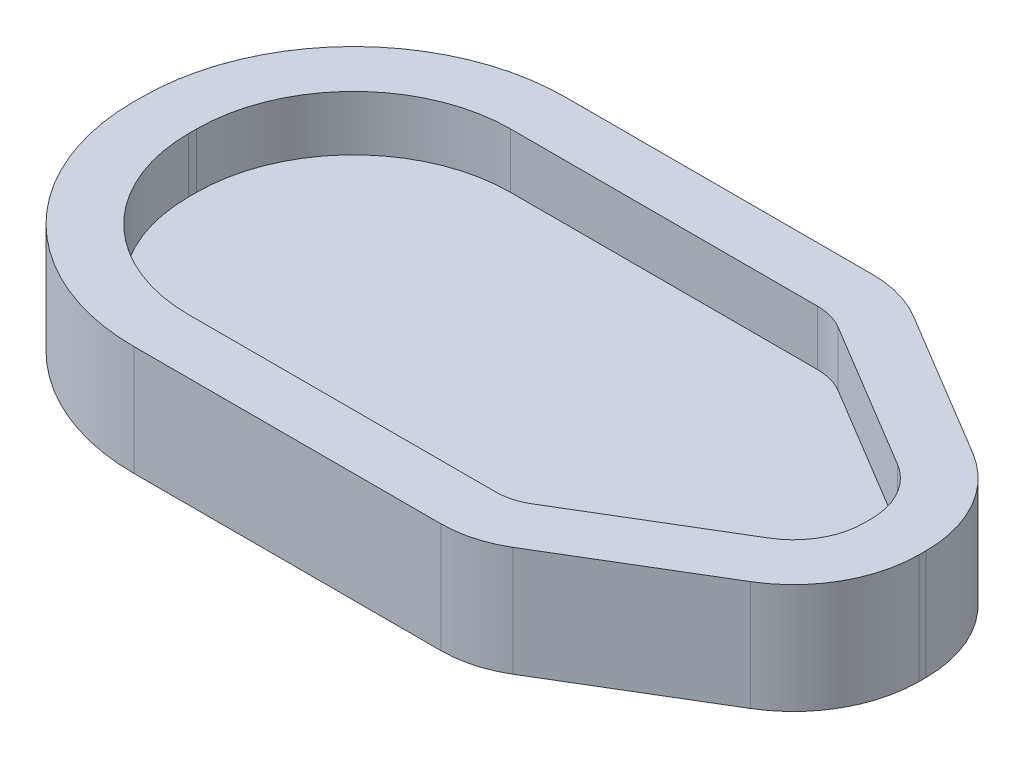
from build123d import *

# Parameters (mm, degrees)
SKETCH1_W           = 50
SKETCH1_H           = 27.5
BOSS_EXTRUDE1_DEPTH = 7
FILLET1_R           = 13.5
CUT_EXTRUDE1_REACH  = 31.378
FILLET2_R           = 8
FILLET3_R           = 7
SHELL1_T            = -3.5


with BuildPart() as part:
    # Sketch1 → Boss-Extrude1 (new body)
    with BuildSketch(Plane(origin=(0, 0, 0), x_dir=(1, 0, 0), z_dir=(0, 1, 0))):
        Rectangle(SKETCH1_W, SKETCH1_H)
    extrude(amount=BOSS_EXTRUDE1_DEPTH)

    # Fillet1
    fillet1_edges = [part.edges().sort_by_distance(p)[0] for p in [
        (-25, 3.5, 13.75),
        (-25, 3.5, -13.75),
    ]]
    fillet(fillet1_edges, radius=FILLET1_R)

    # Sketch3 → Cut-Extrude1 (cut, up to next)
    with BuildSketch(Plane(origin=(0, 7, 0), x_dir=(1, 0, 0), z_dir=(0, 1, 0)), mode=Mode.PRIVATE) as cut_extrude1_sk1:
        Polygon((10, 13.75), (25, 4.75), (25, 13.75), align=None)
    cut_extrude1_tool1 = extrude(cut_extrude1_sk1.sketch, amount=-CUT_EXTRUDE1_REACH, mode=Mode.PRIVATE) & part.part
    # Sketch3 → Cut-Extrude1 (cut, up to next)
    with BuildSketch(Plane(origin=(0, 7, 0), x_dir=(1, 0, 0), z_dir=(0, 1, 0)), mode=Mode.PRIVATE) as cut_extrude1_sk2:
        Polygon((25, -13.75), (10, -13.75), (25, -4.75), align=None)
    cut_extrude1_tool2 = extrude(cut_extrude1_sk2.sketch, amount=-CUT_EXTRUDE1_REACH, mode=Mode.PRIVATE) & part.part
    add(cut_extrude1_tool1.solids().sort_by_distance((20, 7, -10.75))[0], mode=Mode.SUBTRACT)
    add(cut_extrude1_tool2.solids().sort_by_distance((20, 7, 10.75))[0], mode=Mode.SUBTRACT)

    # Fillet2
    fillet2_edges = [part.edges().sort_by_distance(p)[0] for p in [
        (25, 3.5, -4.75),
        (25, 3.5, 4.75),
    ]]
    fillet(fillet2_edges, radius=FILLET2_R)

    # Fillet3
    fillet3_edges = [part.edges().sort_by_distance(p)[0] for p in [
        (10, 3.5, -13.75),
        (10, 3.5, 13.75),
    ]]
    fillet(fillet3_edges, radius=FILLET3_R)

    # Shell1
    shell1_openings = [part.faces().sort_by_distance(p)[0] for p in [
        (-0.99153661, 7, 0),
    ]]
    offset(amount=SHELL1_T, openings=shell1_openings, kind=Kind.INTERSECTION)


solid = part.part
